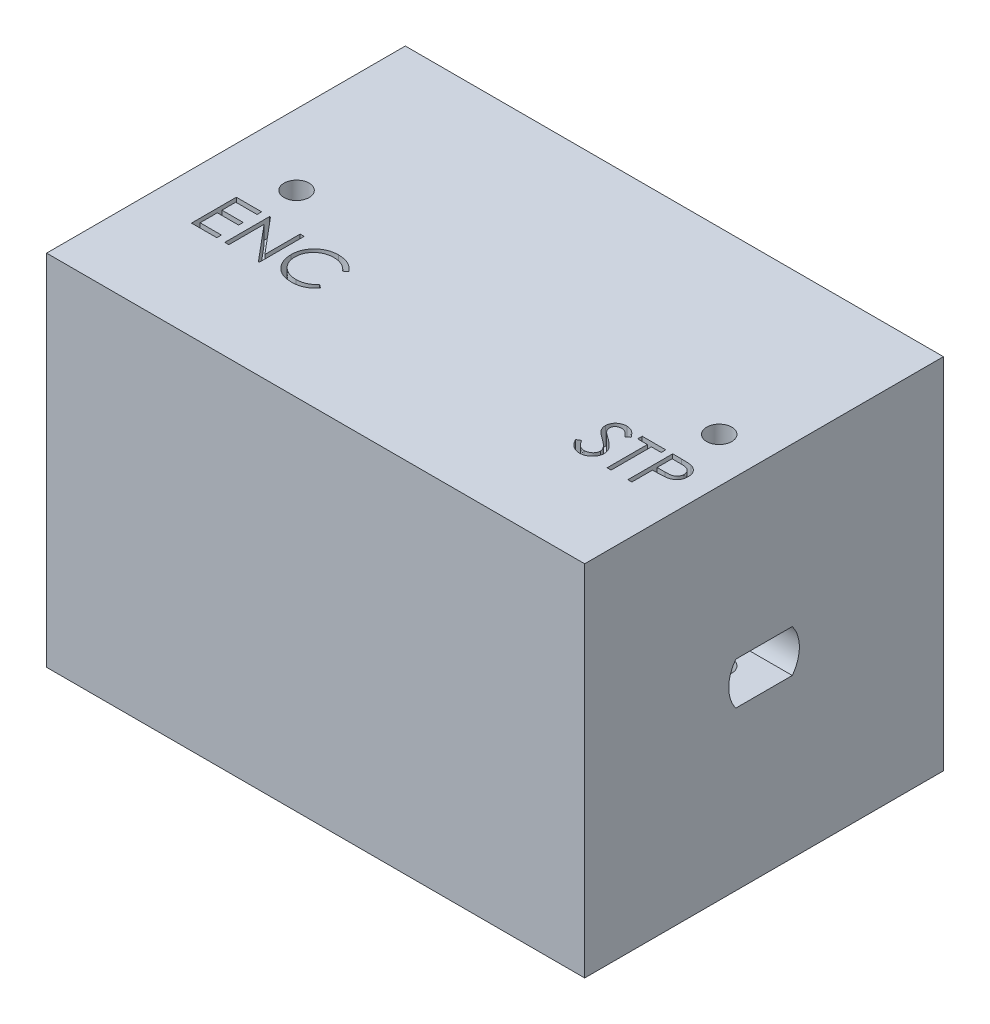
from build123d import *

# Parameters (mm, degrees)
SKETCH1_W           = 25.4
SKETCH1_H           = 25.4
SKETCH1_R           = 1.5
BOSS_EXTRUDE1_DEPTH = 38.1
CUT_EXTRUDE2_DEPTH  = 1.27
CUT_EXTRUDE3_DEPTH  = 1.27
CUT_EXTRUDE4_DEPTH  = 19.05
CUT_EXTRUDE5_DEPTH  = 19.05
SKETCH2_R           = 0.889
CUT_EXTRUDE6_DEPTH  = 25.4


with BuildPart() as part:
    # Sketch1 → Boss-Extrude1 (new body)
    with BuildSketch(Plane(origin=(0, 0, 0), x_dir=(0, 0, -1), z_dir=(1, 0, 0))):
        with Locations((6.249206349, 2.419047619)):
            Rectangle(SKETCH1_W, SKETCH1_H)
        with Locations(Location((6.249206349, 2.419047619, 0), (0, 0, 180))):
            Circle(SKETCH1_R, mode=Mode.SUBTRACT)
    extrude(amount=BOSS_EXTRUDE1_DEPTH)

    # Sketch5 → Cut-Extrude2 (cut)
    with BuildSketch(Plane(origin=(0, 15.119047619, 0), x_dir=(1, 0, 0), z_dir=(0, 1, 0))):
        Polygon((3.289795154, 3.694035644), (5.080820795, 3.694035644), (5.080820795, 3.368394618), (3.574731052, 3.368394618), (3.574731052, 2.391471541), (5.080820795, 2.391471541), (5.080820795, 2.065830516), (3.574731052, 2.065830516), (3.574731052, 0.84467667), (5.080820795, 0.84467667), (5.080820795, 0.519035644), (3.289795154, 0.519035644), align=None)
        Polygon((5.65069259, 0.519035644), (5.65069259, 3.694035644), (5.710478247, 3.694035644), (7.808064385, 1.195122383), (7.808064385, 3.694035644), (8.093000282, 3.694035644), (8.093000282, 0.519035644), (8.028126484, 0.519035644), (5.935628488, 3.012224746), (5.935628488, 0.519035644), align=None)
        with BuildLine():
            Line((11.837872077, 3.111443496), (11.588553167, 2.920638208))
            add(Edge.make_bspline(
                [(11.588553167, 2.920638208), (11.570767825, 2.941834481), (11.535436927, 2.983941254), (11.478596079, 3.043068412), (11.41935816, 3.098463328), (11.357745815, 3.15038989), (11.292650042, 3.197032242), (11.225647746, 3.240821028), (11.155618091, 3.280071048), (11.058779017, 3.327662471), (10.932098469, 3.377325054), (10.772627437, 3.418965843), (10.606156654, 3.445473624), (10.492584546, 3.448344587), (10.434817189, 3.449804875)],
                knots=[0, 0, 0, 0, 0.757959112, 1.505699292, 2.245454638, 2.979532153, 3.711538275, 4.438200793, 5.171680507, 5.909471876, 7.393775596, 8.890124382, 10.418191784, 12, 12, 12, 12], degree=3))
            add(Edge.make_bspline(
                [(10.434817189, 3.449804875), (10.402991625, 3.449438423), (10.339635868, 3.448708921), (10.245611895, 3.439084928), (10.153343627, 3.425558331), (10.062891083, 3.405487502), (9.974369399, 3.38011234), (9.887199863, 3.349790715), (9.802644533, 3.312275967), (9.719533703, 3.270812046), (9.639905419, 3.223978578), (9.564562625, 3.172894323), (9.493780111, 3.118130928), (9.427501885, 3.059483139), (9.365660189, 2.997215075), (9.308703128, 2.930663136), (9.256827792, 2.860040093), (9.209005919, 2.786277216), (9.166177225, 2.709589363), (9.130317977, 2.629692692), (9.098563331, 2.547955398), (9.073436161, 2.463453988), (9.053547492, 2.37678305), (9.03982454, 2.287709978), (9.030309999, 2.196420855), (9.029584124, 2.134545264), (9.029218231, 2.103355556)],
                knots=[0, 0, 0, 0, 1.054917814, 2.100044995, 3.131103042, 4.146048494, 5.169673617, 6.183595914, 7.203665975, 8.234915748, 9.262203917, 10.264457458, 11.251630812, 12.227803204, 13.197192746, 14.159520551, 15.12972552, 16.100847026, 17.073214652, 18.039054194, 19.002613845, 19.979014051, 20.95965708, 21.949030935, 22.966165397, 24, 24, 24, 24], degree=3))
            add(Edge.make_bspline(
                [(9.029218231, 2.103355556), (9.030362881, 2.056427858), (9.03261025, 1.964291549), (9.052611239, 1.829335353), (9.083005143, 1.700048741), (9.128557845, 1.577239884), (9.184727269, 1.459394445), (9.255702681, 1.348506343), (9.337904826, 1.242899888), (9.432496621, 1.145070928), (9.536279039, 1.055704906), (9.647628931, 0.977009735), (9.766268963, 0.911409806), (9.890889192, 0.856821626), (10.022448595, 0.814860166), (10.160710595, 0.785319854), (10.305374476, 0.766050162), (10.404225289, 0.764205316), (10.454533736, 0.763266413)],
                knots=[0, 0, 0, 0, 1.029171465, 2.020641659, 2.987623507, 3.938342917, 4.889210282, 5.84687017, 6.821220943, 7.821438502, 8.827599549, 9.822697543, 10.807740252, 11.797342354, 12.80366471, 13.83203677, 14.896651826, 16, 16, 16, 16], degree=3))
            add(Edge.make_bspline(
                [(10.454533736, 0.763266413), (10.509962604, 0.764798378), (10.619059876, 0.76781365), (10.779050871, 0.793358112), (10.93220903, 0.834776366), (11.07854259, 0.89274091), (11.217639019, 0.968092992), (11.34971599, 1.059440353), (11.474884986, 1.167651912), (11.550151792, 1.250277321), (11.588553167, 1.29243308)],
                knots=[0, 0, 0, 0, 1.028121516, 2.023589091, 2.998037872, 3.967518031, 4.937445131, 5.927275754, 6.942489185, 8, 8, 8, 8], degree=3))
            Line((11.588553167, 1.29243308), (11.837872077, 1.103535844))
            add(Edge.make_bspline(
                [(11.837872077, 1.103535844), (11.817807792, 1.077647391), (11.777775328, 1.02599449), (11.712952698, 0.953176582), (11.644665436, 0.884683635), (11.572406327, 0.821067865), (11.497006616, 0.761056314), (11.417112447, 0.706353938), (11.333774111, 0.656197208), (11.247273976, 0.610271355), (11.157703949, 0.569524995), (11.065171354, 0.534641934), (10.970075047, 0.504592927), (10.872410678, 0.479871527), (10.77197567, 0.460575616), (10.669132454, 0.447676339), (10.563659068, 0.438839031), (10.492501493, 0.438033564), (10.456441789, 0.437625388)],
                knots=[0, 0, 0, 0, 0.986787822, 1.968848986, 2.935600012, 3.899624008, 4.868462664, 5.837806735, 6.815139263, 7.798259679, 8.787526145, 9.778297419, 10.776456485, 11.791383307, 12.812564526, 13.85620153, 14.913611965, 16, 16, 16, 16], degree=3))
            add(Edge.make_bspline(
                [(10.456441789, 0.437625388), (10.422293605, 0.437863052), (10.354769801, 0.438333005), (10.255075933, 0.445945899), (10.158021099, 0.456332446), (10.063882688, 0.471971708), (9.972146982, 0.490426931), (9.883645595, 0.515165857), (9.797507654, 0.542878315), (9.714079231, 0.575449267), (9.63328936, 0.612203233), (9.555398617, 0.653742718), (9.480442825, 0.69971841), (9.40768505, 0.749116884), (9.338200099, 0.803524865), (9.27138583, 0.86218674), (9.206867584, 0.924904793), (9.166950862, 0.970130267), (9.146881492, 0.992868777)],
                knots=[0, 0, 0, 0, 1.114604814, 2.203992996, 3.262667896, 4.300477797, 5.318619304, 6.316056647, 7.298880507, 8.271930387, 9.238335007, 10.195173496, 11.151986948, 12.108099108, 13.064862484, 14.031167946, 15.010108607, 16, 16, 16, 16], degree=3))
            add(Edge.make_bspline(
                [(9.146881492, 0.992868777), (9.114736301, 1.032366855), (9.050834005, 1.110886157), (8.969077135, 1.238145583), (8.899093281, 1.371013172), (8.84250941, 1.510186965), (8.798274645, 1.655354666), (8.767630275, 1.806589454), (8.747717034, 1.963750088), (8.745439843, 2.070644889), (8.744282334, 2.124980155)],
                knots=[0, 0, 0, 0, 0.994628077, 1.977248131, 2.950237994, 3.925870899, 4.908910175, 5.911660606, 6.938484602, 8, 8, 8, 8], degree=3))
            add(Edge.make_bspline(
                [(8.744282334, 2.124980155), (8.745693116, 2.182089745), (8.748468743, 2.294449298), (8.772050644, 2.459344241), (8.809986266, 2.617324439), (8.863867729, 2.768094979), (8.932180441, 2.912448876), (9.016568869, 3.049283397), (9.116052634, 3.179473637), (9.229851499, 3.301044161), (9.354644724, 3.41220486), (9.488283934, 3.510000488), (9.630507557, 3.591387091), (9.779748751, 3.659419324), (9.937125048, 3.711711087), (10.102300676, 3.748317192), (10.274965263, 3.771102005), (10.392769035, 3.773982372), (10.452625683, 3.7754459)],
                knots=[0, 0, 0, 0, 1.032925535, 2.032216505, 3.007276963, 3.968222605, 4.92396291, 5.891752235, 6.871517503, 7.883894988, 8.900124299, 9.891468569, 10.874487609, 11.85992873, 12.854644235, 13.869047385, 14.917252991, 16, 16, 16, 16], degree=3))
            add(Edge.make_bspline(
                [(10.452625683, 3.7754459), (10.489105954, 3.775008532), (10.561314977, 3.774142806), (10.668133454, 3.765700805), (10.772130422, 3.751627748), (10.873377527, 3.732472456), (10.972367329, 3.708698672), (11.068343262, 3.677728544), (11.161868499, 3.642316834), (11.252353195, 3.601533082), (11.339363208, 3.555752538), (11.42287144, 3.505482651), (11.502214562, 3.450785742), (11.577950874, 3.392127004), (11.648813437, 3.328265454), (11.716814207, 3.260957635), (11.779643899, 3.188264809), (11.818427155, 3.137097476), (11.837872077, 3.111443496)],
                knots=[0, 0, 0, 0, 1.096760587, 2.17092713, 3.219439832, 4.250915756, 5.268269357, 6.278326846, 7.281116186, 8.274029601, 9.260640565, 10.235837813, 11.203064059, 12.156899882, 13.114053108, 14.069676657, 15.032185724, 16, 16, 16, 16], degree=3))
        make_face()
    extrude(amount=-CUT_EXTRUDE2_DEPTH, mode=Mode.SUBTRACT)

    # Sketch4 → Cut-Extrude3 (cut)
    # profile 1 of 3: a face of its own
    with BuildSketch(Plane(origin=(0, 15.119047619, 0), x_dir=(1, 0, 0), z_dir=(0, 1, 0))):
        with BuildLine():
            Line((30.158007725, 0.844878313), (30.426407164, 1.005790773))
            add(Edge.make_bspline(
                [(30.426407164, 1.005790773), (30.451370136, 0.964003795), (30.499198228, 0.883941558), (30.578982675, 0.775757479), (30.661653245, 0.683807522), (30.74782214, 0.6086266), (30.836963393, 0.549436538), (30.929658928, 0.507524514), (31.02559637, 0.481384307), (31.090886908, 0.478209229), (31.123482485, 0.476624106)],
                knots=[0, 0, 0, 0, 1.272034388, 2.437168799, 3.508375237, 4.49857839, 5.41946034, 6.295179144, 7.148887113, 8, 8, 8, 8], degree=3))
            add(Edge.make_bspline(
                [(31.123482485, 0.476624106), (31.151319851, 0.477399416), (31.206507495, 0.47893647), (31.287753244, 0.493705483), (31.366658165, 0.516395058), (31.441596, 0.54888976), (31.511532736, 0.588203957), (31.572861667, 0.635689418), (31.625880641, 0.688853619), (31.669250338, 0.748165027), (31.70252437, 0.811952727), (31.728098603, 0.877426625), (31.74229092, 0.945615255), (31.744428832, 0.991526175), (31.745507725, 1.01469502)],
                knots=[0, 0, 0, 0, 1.095163259, 2.171163733, 3.241058638, 4.321873601, 5.38011039, 6.391990106, 7.366004449, 8.327778327, 9.272591725, 10.192022065, 11.087607919, 12, 12, 12, 12], degree=3))
            add(Edge.make_bspline(
                [(31.745507725, 1.01469502), (31.744170315, 1.041129933), (31.741451555, 1.09486825), (31.718472283, 1.174152221), (31.682323324, 1.252613338), (31.648974354, 1.301146629), (31.631660569, 1.326343657)],
                knots=[0, 0, 0, 0, 0.938893495, 1.908633276, 2.914225137, 4, 4, 4, 4], degree=3))
            add(Edge.make_bspline(
                [(31.631660569, 1.326343657), (31.617445084, 1.34452899), (31.58760145, 1.382706822), (31.536295706, 1.439535), (31.47609216, 1.498153137), (31.409051078, 1.560799567), (31.332730347, 1.62456064), (31.249520388, 1.692476863), (31.157296744, 1.761965437), (31.092617915, 1.808567693), (31.059244704, 1.832613689)],
                knots=[0, 0, 0, 0, 0.722233717, 1.516239348, 2.393582979, 3.351407094, 4.387010283, 5.505090956, 6.712668013, 8, 8, 8, 8], degree=3))
            add(Edge.make_bspline(
                [(31.059244704, 1.832613689), (31.025840079, 1.856406765), (30.96197298, 1.901897315), (30.87265698, 1.969410772), (30.792788074, 2.031136282), (30.722721252, 2.087654922), (30.662487332, 2.138974356), (30.611611666, 2.184601773), (30.571390261, 2.225771146), (30.549024127, 2.252478648), (30.538982284, 2.264469659)],
                knots=[0, 0, 0, 0, 1.452282411, 2.77665338, 3.964542531, 5.026858415, 5.96415736, 6.766646006, 7.446254459, 8, 8, 8, 8], degree=3))
            add(Edge.make_bspline(
                [(30.538982284, 2.264469659), (30.524946475, 2.283157742), (30.497343173, 2.319910367), (30.460906869, 2.377355059), (30.429937771, 2.436159021), (30.405660512, 2.49648027), (30.385216942, 2.557471955), (30.371466534, 2.619929871), (30.362856481, 2.68357376), (30.36197475, 2.72640315), (30.361533366, 2.747843056)],
                knots=[0, 0, 0, 0, 1.068054152, 2.10047183, 3.106115577, 4.101338837, 5.06977816, 6.043150881, 7.020423561, 8, 8, 8, 8], degree=3))
            add(Edge.make_bspline(
                [(30.361533366, 2.747843056), (30.362717377, 2.781434352), (30.365060092, 2.847898953), (30.384872561, 2.944991206), (30.4161444, 3.037688884), (30.459954763, 3.125074259), (30.516431076, 3.20487197), (30.581787067, 3.277999919), (30.659630343, 3.339475704), (30.745040223, 3.3931895), (30.838527075, 3.435231875), (30.936490252, 3.466946478), (31.039085453, 3.484916305), (31.108575439, 3.487495099), (31.143835049, 3.488803593)],
                knots=[0, 0, 0, 0, 1.005424448, 1.989358655, 2.955360095, 3.929531133, 4.905563448, 5.876582895, 6.856512386, 7.866279853, 8.892233794, 9.918561126, 10.94386622, 12, 12, 12, 12], degree=3))
            add(Edge.make_bspline(
                [(31.143835049, 3.488803593), (31.18124934, 3.487513136), (31.255654423, 3.484946828), (31.365100497, 3.462633353), (31.470474861, 3.425712029), (31.555241252, 3.383812318), (31.621583114, 3.341964534), (31.67217695, 3.30384655), (31.723446352, 3.259963416), (31.775804873, 3.210198243), (31.828365328, 3.154094404), (31.881908031, 3.092036136), (31.936558189, 3.024402689), (31.971715291, 2.976120464), (31.989738494, 2.951368697)],
                knots=[0, 0, 0, 0, 1.286793592, 2.559021753, 3.825965368, 5.121522368, 5.803751409, 6.523245864, 7.299691795, 8.125521123, 9.008227632, 9.944561021, 10.946284179, 12, 12, 12, 12], degree=3))
            Line((31.989738494, 2.951368697), (31.732151355, 2.756111286))
            add(Edge.make_bspline(
                [(31.732151355, 2.756111286), (31.716597545, 2.776148883), (31.686644543, 2.814736612), (31.641169937, 2.868776305), (31.598308663, 2.918139826), (31.556080801, 2.961016049), (31.516716578, 2.999752984), (31.478510404, 3.032917907), (31.4420121, 3.060835768), (31.396004616, 3.090629569), (31.338203543, 3.120162969), (31.265646143, 3.145153918), (31.18982145, 3.160171724), (31.138178142, 3.162157358), (31.112034167, 3.163162568)],
                knots=[0, 0, 0, 0, 1.181633172, 2.275549214, 3.290209073, 4.226197932, 5.078386478, 5.862611352, 6.581680152, 7.217281963, 8.414376989, 9.595101626, 10.782541182, 12, 12, 12, 12], degree=3))
            add(Edge.make_bspline(
                [(31.112034167, 3.163162568), (31.079235036, 3.162063383), (31.015985002, 3.159943708), (30.926186716, 3.136793436), (30.845365798, 3.100342748), (30.775921686, 3.049257018), (30.718103142, 2.988731546), (30.676278905, 2.919082156), (30.651105541, 2.842172405), (30.648033702, 2.788522474), (30.646469263, 2.761199427)],
                knots=[0, 0, 0, 0, 1.14458467, 2.207223713, 3.21896685, 4.227309161, 5.202851033, 6.127160689, 7.046193047, 8, 8, 8, 8], degree=3))
            add(Edge.make_bspline(
                [(30.646469263, 2.761199427), (30.646825885, 2.744189157), (30.647539713, 2.710140802), (30.657495422, 2.659838441), (30.670285527, 2.609663154), (30.690553486, 2.559840525), (30.718534583, 2.509499214), (30.755278564, 2.457772352), (30.801554926, 2.404204016), (30.837003358, 2.369363042), (30.855719063, 2.350968056)],
                knots=[0, 0, 0, 0, 0.858281714, 1.717966888, 2.583508476, 3.4729293, 4.427298488, 5.488583878, 6.674047936, 8, 8, 8, 8], degree=3))
            add(Edge.make_bspline(
                [(30.855719063, 2.350968056), (30.862669022, 2.344765897), (30.879180535, 2.330030987), (30.909366553, 2.305907989), (30.949228949, 2.276151189), (30.997726802, 2.239332695), (31.055754338, 2.196623083), (31.123317935, 2.148568449), (31.199664468, 2.093608782), (31.253840778, 2.055184442), (31.282486892, 2.034867295)],
                knots=[0, 0, 0, 0, 0.420754252, 0.999615792, 1.744751191, 2.668019286, 3.750313428, 4.999500688, 6.413464383, 8, 8, 8, 8], degree=3))
            add(Edge.make_bspline(
                [(31.282486892, 2.034867295), (31.316945542, 2.009792633), (31.383669941, 1.961239026), (31.478609317, 1.888290516), (31.564691558, 1.816945755), (31.642218892, 1.747660354), (31.711957231, 1.68095987), (31.773132877, 1.616041842), (31.826369173, 1.553371358), (31.88368175, 1.473023378), (31.942244915, 1.374343395), (31.992538282, 1.253440993), (32.024250497, 1.132068616), (32.028397515, 1.050492129), (32.030443622, 1.010242896)],
                knots=[0, 0, 0, 0, 1.163667725, 2.253281268, 3.268753668, 4.215851969, 5.092017293, 5.902905408, 6.650798638, 7.335211899, 8.59617414, 9.77448103, 10.901945474, 12, 12, 12, 12], degree=3))
            add(Edge.make_bspline(
                [(32.030443622, 1.010242896), (32.029847504, 0.981778236), (32.028666844, 0.925401681), (32.015095158, 0.84262029), (31.99521089, 0.76221943), (31.9652414, 0.685192921), (31.928662535, 0.6101316), (31.882247438, 0.539004433), (31.828446896, 0.4702372), (31.766730552, 0.405663605), (31.699197483, 0.34638527), (31.627820132, 0.293653907), (31.55248167, 0.249686213), (31.473590797, 0.21380795), (31.391129391, 0.18574683), (31.305125188, 0.165415156), (31.215436417, 0.152936761), (31.15447598, 0.151641577), (31.123482485, 0.15098308)],
                knots=[0, 0, 0, 0, 0.983748083, 1.948392443, 2.894712957, 3.844097841, 4.80183111, 5.778335162, 6.776009319, 7.81870978, 8.863265674, 9.881300176, 10.883814829, 11.87499822, 12.874611388, 13.892143829, 14.928324115, 16, 16, 16, 16], degree=3))
            add(Edge.make_bspline(
                [(31.123482485, 0.15098308), (31.099501852, 0.151446795), (31.051842598, 0.152368385), (30.981348997, 0.160515689), (30.912279512, 0.172042847), (30.845500842, 0.190343611), (30.780152619, 0.212547726), (30.716519056, 0.239887499), (30.654569314, 0.27265096), (30.593956221, 0.310111447), (30.534833934, 0.353706686), (30.477756988, 0.404482644), (30.420852656, 0.461038923), (30.365800518, 0.524911363), (30.311487023, 0.595068052), (30.258983037, 0.672165383), (30.207201764, 0.755783411), (30.174712019, 0.81462531), (30.158007725, 0.844878313)],
                knots=[0, 0, 0, 0, 0.915332311, 1.819136955, 2.706846663, 3.586547465, 4.459518054, 5.340707479, 6.227863349, 7.133153174, 8.059268498, 9.028702269, 10.047606654, 11.120612155, 12.245963614, 13.433783089, 14.680604001, 16, 16, 16, 16], degree=3))
        make_face()
    # profile 2 of 3: a face of its own
    with BuildSketch(Plane(origin=(0, 15.119047619, 0), x_dir=(1, 0, 0), z_dir=(0, 1, 0))):
        Polygon((32.31537952, 3.081752311), (32.31537952, 3.407393337), (33.984289776, 3.407393337), (33.984289776, 3.081752311), (33.292302597, 3.081752311), (33.292302597, 0.232393337), (33.007366699, 0.232393337), (33.007366699, 3.081752311), align=None)
    # profile 3 of 3: a face of its own
    with BuildSketch(Plane(origin=(0, 15.119047619, 0), x_dir=(1, 0, 0), z_dir=(0, 1, 0))):
        with BuildLine():
            Line((34.472751315, 3.407393337), (35.095412573, 3.407393337))
            add(Edge.make_bspline(
                [(35.095412573, 3.407393337), (35.138239609, 3.40734626), (35.220298112, 3.407256057), (35.337968199, 3.404521252), (35.444838455, 3.400868467), (35.540678444, 3.395804893), (35.625783047, 3.389820843), (35.699767169, 3.381427921), (35.763212338, 3.372664653), (35.801227474, 3.363755235), (35.818564616, 3.359692015)],
                knots=[0, 0, 0, 0, 1.415646017, 2.712440637, 3.8905458, 4.950247383, 5.884950622, 6.709939814, 7.411656543, 8, 8, 8, 8], degree=3))
            add(Edge.make_bspline(
                [(35.818564616, 3.359692015), (35.840511607, 3.35368496), (35.883888437, 3.3418124), (35.946391526, 3.318032808), (36.005858228, 3.289836844), (36.062492571, 3.25770227), (36.115598603, 3.220250365), (36.165968655, 3.178999298), (36.213158208, 3.13299666), (36.256901899, 3.082758418), (36.297074537, 3.029127942), (36.331663607, 2.971304633), (36.360626163, 2.910261808), (36.385466702, 2.846041926), (36.403345085, 2.778105704), (36.416813344, 2.706925186), (36.425361921, 2.632508003), (36.426180673, 2.581653694), (36.426597469, 2.555765733)],
                knots=[0, 0, 0, 0, 0.999701418, 1.975846123, 2.934577507, 3.890451536, 4.834027766, 5.787354733, 6.749476667, 7.726910423, 8.712836071, 9.690891519, 10.682875813, 11.679750201, 12.712814741, 13.765529915, 14.8625177, 16, 16, 16, 16], degree=3))
            add(Edge.make_bspline(
                [(36.426597469, 2.555765733), (36.426215176, 2.529660178), (36.425467195, 2.478582897), (36.416489851, 2.403859011), (36.404397462, 2.332450185), (36.385803708, 2.264514755), (36.361450847, 2.200456164), (36.332883056, 2.139295474), (36.298426568, 2.082073201), (36.258834473, 2.028581601), (36.214791241, 1.978770466), (36.166483218, 1.93300076), (36.114105431, 1.891540396), (36.05782434, 1.854296427), (35.997091263, 1.822132516), (35.932827309, 1.793324104), (35.864473899, 1.769129642), (35.817173189, 1.756402372), (35.793123911, 1.749931398)],
                knots=[0, 0, 0, 0, 1.121902311, 2.195077645, 3.232258892, 4.234102512, 5.217864754, 6.176164875, 7.132989551, 8.084763148, 9.034132444, 9.988522005, 10.94243251, 11.903244335, 12.886203696, 13.894208494, 14.929344452, 16, 16, 16, 16], degree=3))
            add(Edge.make_bspline(
                [(35.793123911, 1.749931398), (35.773232686, 1.745701408), (35.729639912, 1.736431139), (35.657846156, 1.726082039), (35.574257128, 1.717248644), (35.478986917, 1.710625469), (35.372121039, 1.704955492), (35.253601684, 1.700448721), (35.1231962, 1.697972354), (35.032235857, 1.697844634), (34.984745505, 1.697777952)],
                knots=[0, 0, 0, 0, 0.601384939, 1.31797006, 2.144135048, 3.087295005, 4.142315834, 5.309527816, 6.595305764, 8, 8, 8, 8], degree=3))
            Line((34.984745505, 1.697777952), (34.757687212, 1.697777952))
            Line((34.757687212, 1.697777952), (34.757687212, 0.232393337))
            Line((34.757687212, 0.232393337), (34.472751315, 0.232393337))
            Line((34.472751315, 0.232393337), (34.472751315, 3.407393337))
        make_face()
        with BuildLine():
            Line((34.757687212, 3.081752311), (34.757687212, 2.023418978))
            Line((34.757687212, 2.023418978), (35.313566619, 2.016422784))
            add(Edge.make_bspline(
                [(35.313566619, 2.016422784), (35.340708266, 2.016408756), (35.393104656, 2.016381676), (35.46879323, 2.019996843), (35.539014512, 2.024170183), (35.603552805, 2.030280628), (35.662437203, 2.038917769), (35.71576589, 2.047636988), (35.763125354, 2.060251139), (35.818551058, 2.077235637), (35.880312381, 2.106203081), (35.947502228, 2.148249053), (36.004444117, 2.201843696), (36.053718572, 2.262103228), (36.092821761, 2.329140296), (36.121447555, 2.400867117), (36.138267033, 2.476548095), (36.140522366, 2.528335192), (36.141661571, 2.554493697)],
                knots=[0, 0, 0, 0, 1.160613943, 2.240541288, 3.23993089, 4.169200891, 5.011653406, 5.7853311, 6.478053781, 7.106038997, 8.262395093, 9.384106736, 10.481365981, 11.59014053, 12.70357646, 13.786202915, 14.881775077, 16, 16, 16, 16], degree=3))
            add(Edge.make_bspline(
                [(36.141661571, 2.554493697), (36.14051617, 2.580019349), (36.138239255, 2.630761185), (36.121315722, 2.705127632), (36.092877416, 2.776098592), (36.053456077, 2.842295606), (36.005612338, 2.902338306), (35.950005076, 2.954496414), (35.886765189, 2.996426102), (35.82793858, 3.02348915), (35.775686075, 3.040013007), (35.73029994, 3.051574398), (35.679054828, 3.060805127), (35.621934057, 3.068279533), (35.559380358, 3.07467803), (35.490856315, 3.079019595), (35.41662151, 3.081560916), (35.365086206, 3.081686968), (35.338371307, 3.081752311)],
                knots=[0, 0, 0, 0, 1.120700087, 2.227813068, 3.331159281, 4.466773991, 5.599788987, 6.693661531, 7.80175334, 8.91857717, 9.525282508, 10.207424825, 10.974604443, 11.810962634, 12.737642355, 13.736264703, 14.826523623, 16, 16, 16, 16], degree=3))
            Line((35.338371307, 3.081752311), (34.757687212, 3.081752311))
        make_face(mode=Mode.SUBTRACT)
    extrude(amount=-CUT_EXTRUDE3_DEPTH, mode=Mode.SUBTRACT)

    # Sketch6 → Cut-Extrude4 (cut)
    with BuildSketch(Plane.ZY):
        with BuildLine():
            Line((-8.847282561, 3.919047619), (-3.651130138, 3.919047619))
            ThreePointArc((-3.651130138, 3.919047619), (-6.249206349, -0.580952381), (-8.847282561, 3.919047619))
        make_face()
    extrude(amount=-CUT_EXTRUDE4_DEPTH, mode=Mode.SUBTRACT)

    # Sketch7 → Cut-Extrude5 (cut)
    with BuildSketch(Plane(origin=(38.1, 0, 0), x_dir=(0, 0, -1), z_dir=(1, 0, 0))):
        with BuildLine():
            Line((4.249206349, 0.919047619), (8.249206349, 0.919047619))
            ThreePointArc((8.249206349, 0.919047619), (8.749206349, 2.419047619), (8.249206349, 3.919047619))
            Line((8.249206349, 3.919047619), (4.249206349, 3.919047619))
            ThreePointArc((4.249206349, 3.919047619), (3.749206349, 2.419047619), (4.249206349, 0.919047619))
        make_face()
    extrude(amount=-CUT_EXTRUDE5_DEPTH, mode=Mode.SUBTRACT)

    # Sketch2 → Cut-Extrude6 (cut)
    with BuildSketch(Plane(origin=(0, 15.119047619, 0), x_dir=(1, 0, 0), z_dir=(0, 1, 0))):
        with Locations(Location((5, 6.249206349, 0), (0, 0, 270))):
            Circle(SKETCH2_R)
        with Locations(Location((34.925, 6.249206349, 0), (0, 0, 270))):
            Circle(SKETCH2_R)
    extrude(amount=-CUT_EXTRUDE6_DEPTH, mode=Mode.SUBTRACT)


solid = part.part
